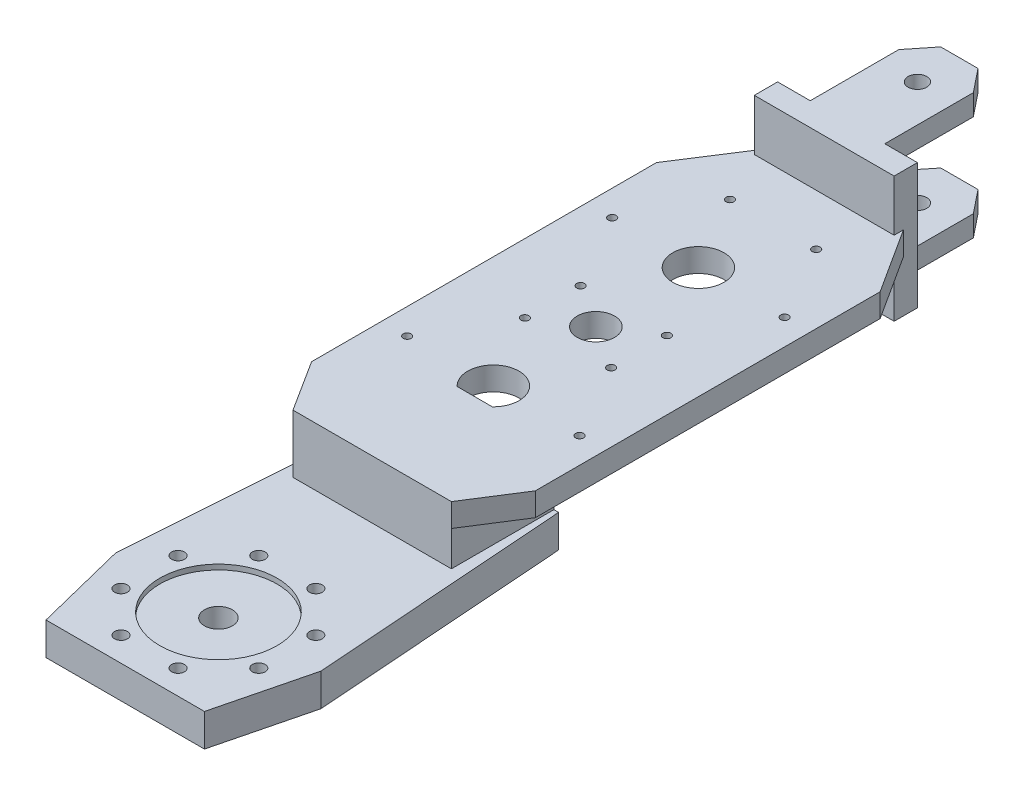
from build123d import *

# Parameters (mm, degrees)
SK_KNEE_PLATE_R         = 2.75
SK_KNEE_PLATE_R_2       = 6
KNEE_PLATE_DEPTH        = 14
SK_KNEE_PILOT_RECESS_R  = 25.15
KNEE_PILOT_RECESS_DEPTH = 2.2
SK_JOGGLE_W             = 68
SK_JOGGLE_H             = 39
JOGGLE_DEPTH            = 44
SK_WEB_R                = 1.7
SK_WEB_R_2              = 11
SK_WEB_R_3              = 8
WEB_DEPTH               = 10
SK_FORK_BAR_W           = 60
SK_FORK_BAR_H           = 54
FORK_BAR_DEPTH          = 10
SK_TINE_LAT_R           = 4
TINE_LAT_DEPTH          = 9
SK_TINE_MED_R           = 4
TINE_MED_DEPTH          = 9


with BuildPart() as part:
    # SK_Knee_Plate → Knee_Plate (new body)
    with BuildSketch(Plane(origin=(0, -34, 0), x_dir=(1, 0, 0), z_dir=(0, 1, 0))):
        Polygon((-34, -40), (34, -40), (44, 0), (36, 110), (-36, 110), (-44, 0), align=None)
        with Locations((29.56414504, 12.245869836)):
            Circle(SK_KNEE_PLATE_R, mode=Mode.SUBTRACT)
        with Locations((12.245869836, 29.56414504)):
            Circle(SK_KNEE_PLATE_R, mode=Mode.SUBTRACT)
        with Locations((-12.245869836, 29.56414504)):
            Circle(SK_KNEE_PLATE_R, mode=Mode.SUBTRACT)
        with Locations((-29.56414504, 12.245869836)):
            Circle(SK_KNEE_PLATE_R, mode=Mode.SUBTRACT)
        with Locations((-29.56414504, -12.245869836)):
            Circle(SK_KNEE_PLATE_R, mode=Mode.SUBTRACT)
        with Locations((-12.245869836, -29.56414504)):
            Circle(SK_KNEE_PLATE_R, mode=Mode.SUBTRACT)
        with Locations((12.245869836, -29.56414504)):
            Circle(SK_KNEE_PLATE_R, mode=Mode.SUBTRACT)
        with Locations((29.56414504, -12.245869836)):
            Circle(SK_KNEE_PLATE_R, mode=Mode.SUBTRACT)
        Circle(SK_KNEE_PLATE_R_2, mode=Mode.SUBTRACT)
    extrude(amount=KNEE_PLATE_DEPTH)

    # SK_Knee_Pilot_Recess → Knee_Pilot_Recess (cut)
    with BuildSketch(Plane(origin=(0, -20, 0), x_dir=(1, 0, 0), z_dir=(0, 1, 0))):
        Circle(SK_KNEE_PILOT_RECESS_R)
    extrude(amount=-KNEE_PILOT_RECESS_DEPTH, mode=Mode.SUBTRACT)

    # SK_Joggle → Joggle (add)
    with BuildSketch(Plane.XY.offset(-110)):
        with Locations((0, -14.5)):
            Rectangle(SK_JOGGLE_W, SK_JOGGLE_H)
    extrude(amount=JOGGLE_DEPTH)

    # SK_Web → Web (add)
    with BuildSketch(Plane(origin=(0, -5, 0), x_dir=(1, 0, 0), z_dir=(0, 1, 0))):
        Polygon((-34, 66), (34, 66), (48, 88), (48, 236), (30, 264), (-30, 264), (-48, 236), (-48, 88), align=None)
        with Locations((37, 118)):
            Circle(SK_WEB_R, mode=Mode.SUBTRACT)
        with Locations((18.5, 150.04293994)):
            Circle(SK_WEB_R, mode=Mode.SUBTRACT)
        with Locations((-18.5, 150.04293994)):
            Circle(SK_WEB_R, mode=Mode.SUBTRACT)
        with Locations((-37, 118)):
            Circle(SK_WEB_R, mode=Mode.SUBTRACT)
        with Locations((-18.5, 85.95706006)):
            Circle(SK_WEB_R, mode=Mode.SUBTRACT)
        with Locations((18.5, 85.95706006)):
            Circle(SK_WEB_R, mode=Mode.SUBTRACT)
        with Locations((37, 206)):
            Circle(SK_WEB_R, mode=Mode.SUBTRACT)
        with Locations((18.5, 238.04293994)):
            Circle(SK_WEB_R, mode=Mode.SUBTRACT)
        with Locations((-18.5, 238.04293994)):
            Circle(SK_WEB_R, mode=Mode.SUBTRACT)
        with Locations((-37, 206)):
            Circle(SK_WEB_R, mode=Mode.SUBTRACT)
        with Locations((-18.5, 173.95706006)):
            Circle(SK_WEB_R, mode=Mode.SUBTRACT)
        with Locations((18.5, 173.95706006)):
            Circle(SK_WEB_R, mode=Mode.SUBTRACT)
        with Locations((0, 118)):
            Circle(SK_WEB_R_2, mode=Mode.SUBTRACT)
        with Locations((0, 206)):
            Circle(SK_WEB_R_2, mode=Mode.SUBTRACT)
        with Locations((0, 162)):
            Circle(SK_WEB_R_3, mode=Mode.SUBTRACT)
    extrude(amount=WEB_DEPTH)

    # SK_Fork_Bar → Fork_Bar (add)
    with BuildSketch(Plane.XY.offset(-270)):
        Rectangle(SK_FORK_BAR_W, SK_FORK_BAR_H)
    extrude(amount=FORK_BAR_DEPTH)

    # SK_Tine_Lat → Tine_Lat (add)
    with BuildSketch(Plane(origin=(0, 18, 0), x_dir=(1, 0, 0), z_dir=(0, 1, 0))):
        Polygon((-16, 260), (16, 260), (16, 308), (8, 318), (-8, 318), (-16, 308), align=None)
        with Locations((0, 300)):
            Circle(SK_TINE_LAT_R, mode=Mode.SUBTRACT)
    extrude(amount=TINE_LAT_DEPTH)

    # SK_Tine_Med → Tine_Med (add)
    with BuildSketch(Plane(origin=(0, -27, 0), x_dir=(1, 0, 0), z_dir=(0, 1, 0))):
        Polygon((-16, 260), (16, 260), (16, 308), (8, 318), (-8, 318), (-16, 308), align=None)
        with Locations((0, 300)):
            Circle(SK_TINE_MED_R, mode=Mode.SUBTRACT)
    extrude(amount=TINE_MED_DEPTH)


solid = part.part
